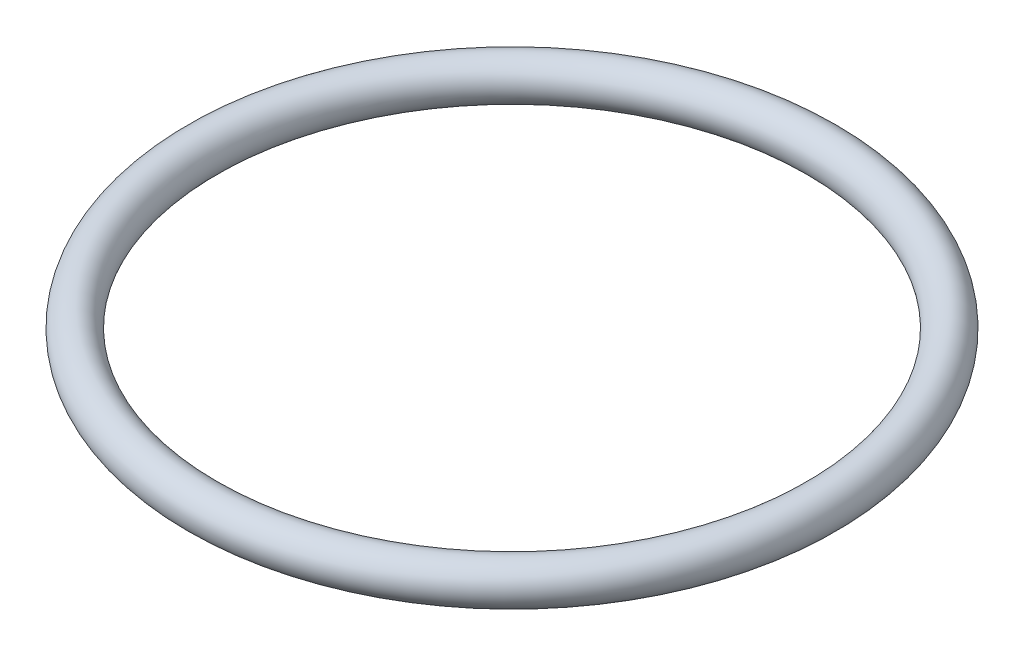
from build123d import *

# Parameters (mm, degrees)
SKETCH1_R = 12.5
SHELL2_T  = 3


with BuildPart() as part:
    # Sketch1 → Revolve1 (revolve)
    with BuildSketch(Plane.XY, mode=Mode.PRIVATE) as revolve1_sk:
        with Locations((190, 0)):
            Circle(SKETCH1_R)
    revolve(revolve1_sk.sketch.rotate(Axis((0, 16.5, 0), (0, -1, 0)), 90), axis=Axis((0, 16.5, 0), (0, -1, 0)))

    # Shell2 (no face opened: a closed hollow body)
    add(offset(amount=-SHELL2_T, mode=Mode.PRIVATE), mode=Mode.SUBTRACT)


solid = part.part
